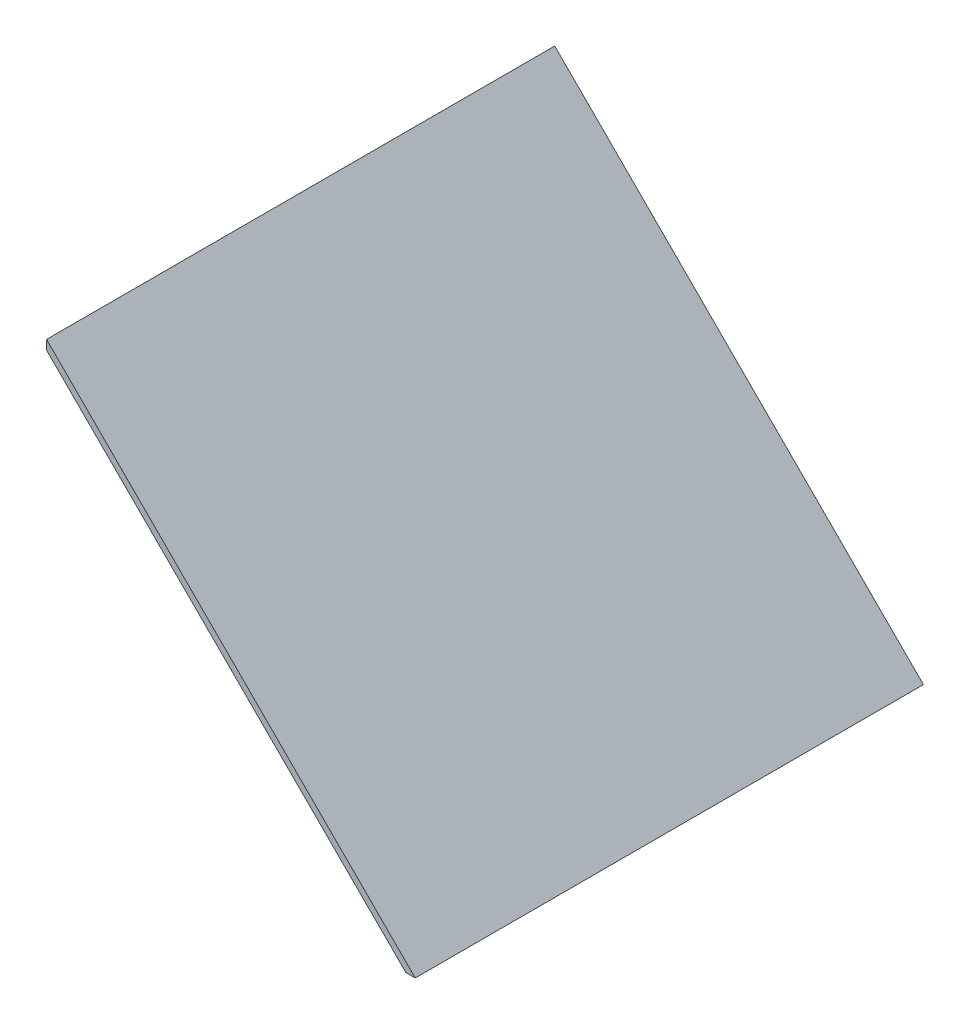
from build123d import *

# Parameters (mm, degrees)
BOSS_EXTRUDE1_DEPTH = 110


with BuildPart() as part:
    # Sketch1 → Boss-Extrude1 (new body)
    with BuildSketch(Plane.XY):
        Polygon((0, 2.032), (0, 0), (77.781745931, -77.781745931), (79.813745931, -77.781745931), align=None)
    extrude(amount=BOSS_EXTRUDE1_DEPTH)


solid = part.part
